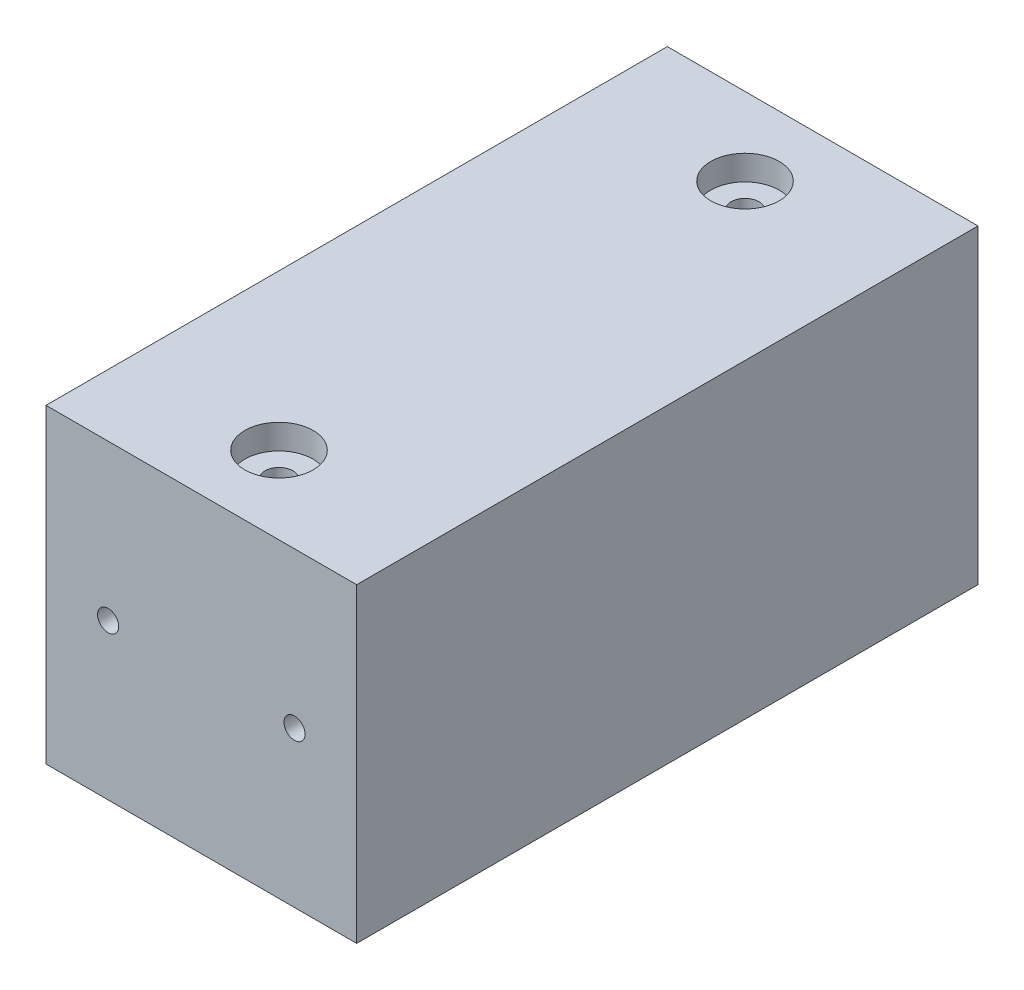
from build123d import *

# Parameters (mm, degrees)
SKIZZE1_W                                           = 100
SKIZZE1_H                                           = 100
AUFSATZ_LINEAR_AUSTRAGEN1_DEPTH                     = 200
STIRNSENKUNG_F_R_M8_SENKSCHRAUBE_KOPF_B_D           = 9
STIRNSENKUNG_F_R_M8_SENKSCHRAUBE_KOPF_B_CBORE_D     = 22
STIRNSENKUNG_F_R_M8_SENKSCHRAUBE_KOPF_B_CBORE_DEPTH = 8
KERNLOCH_F_R_M8X1_252_D                             = 6.8
KERNLOCH_F_R_M8X1_252_DEPTH                         = 30
KERNLOCH_F_R_M8X1_252_TIP                           = 2.042926105
KERNLOCH_F_R_M81_D                                  = 6.8
KERNLOCH_F_R_M81_DEPTH                              = 30
KERNLOCH_F_R_M81_TIP                                = 2.042926105
STIRNSENKUNG_F_R_M8_SENKSCHRAUBE_KO_2_D             = 9
STIRNSENKUNG_F_R_M8_SENKSCHRAUBE_KO_2_CBORE_D       = 15
STIRNSENKUNG_F_R_M8_SENKSCHRAUBE_KO_2_CBORE_DEPTH   = 8


with BuildPart() as part:
    # Skizze1 → Aufsatz-Linear austragen1 (new body)
    with BuildSketch(Plane.XY):
        Rectangle(SKIZZE1_W, SKIZZE1_H)
    extrude(amount=AUFSATZ_LINEAR_AUSTRAGEN1_DEPTH)

    # Stirnsenkung f_r M8 Senkschraube _Kopf B (through all)
    with Locations(Plane(origin=(0, 50, 0), x_dir=(1, 0, 0), z_dir=(0, 1, 0))):
        with Locations((0, -175)):
            stirnsenkung_f_r_m8_senkschraube_kopf_b = CounterBoreHole(STIRNSENKUNG_F_R_M8_SENKSCHRAUBE_KOPF_B_D / 2, STIRNSENKUNG_F_R_M8_SENKSCHRAUBE_KOPF_B_CBORE_D / 2, STIRNSENKUNG_F_R_M8_SENKSCHRAUBE_KOPF_B_CBORE_DEPTH)

    # Spiegeln1: Stirnsenkung f_r M8 Senkschraube _Kopf B across plane
    add(stirnsenkung_f_r_m8_senkschraube_kopf_b.mirror(Plane.XY.offset(100)), mode=Mode.SUBTRACT)

    # Kernloch für M8x1.252
    with Locations(Plane(origin=(0, 0, 0), x_dir=(-1, 0, 0), z_dir=(0, 0, -1))):
        with Locations((-30, 0), (30, 0)):
            Hole(KERNLOCH_F_R_M8X1_252_D / 2, depth=KERNLOCH_F_R_M8X1_252_DEPTH)
            with Locations((0, 0, -(KERNLOCH_F_R_M8X1_252_DEPTH + KERNLOCH_F_R_M8X1_252_TIP / 2))):  # 118° drill point
                Cone(0, KERNLOCH_F_R_M8X1_252_D / 2, KERNLOCH_F_R_M8X1_252_TIP, mode=Mode.SUBTRACT)

    # Kernloch für M81
    with Locations(Plane.XY.offset(200)):
        with Locations((30, 0), (-30, 0)):
            Hole(KERNLOCH_F_R_M81_D / 2, depth=KERNLOCH_F_R_M81_DEPTH)
            with Locations((0, 0, -(KERNLOCH_F_R_M81_DEPTH + KERNLOCH_F_R_M81_TIP / 2))):  # 118° drill point
                Cone(0, KERNLOCH_F_R_M81_D / 2, KERNLOCH_F_R_M81_TIP, mode=Mode.SUBTRACT)

    # Stirnsenkung f_r M8 Senkschraube _Ko 2 (through all)
    with Locations(Plane(origin=(0, -50, 0), x_dir=(-1, 0, 0), z_dir=(0, -1, 0))):
        with Locations((0, -175), (0, -25)):
            CounterBoreHole(STIRNSENKUNG_F_R_M8_SENKSCHRAUBE_KO_2_D / 2, STIRNSENKUNG_F_R_M8_SENKSCHRAUBE_KO_2_CBORE_D / 2, STIRNSENKUNG_F_R_M8_SENKSCHRAUBE_KO_2_CBORE_DEPTH)


solid = part.part
